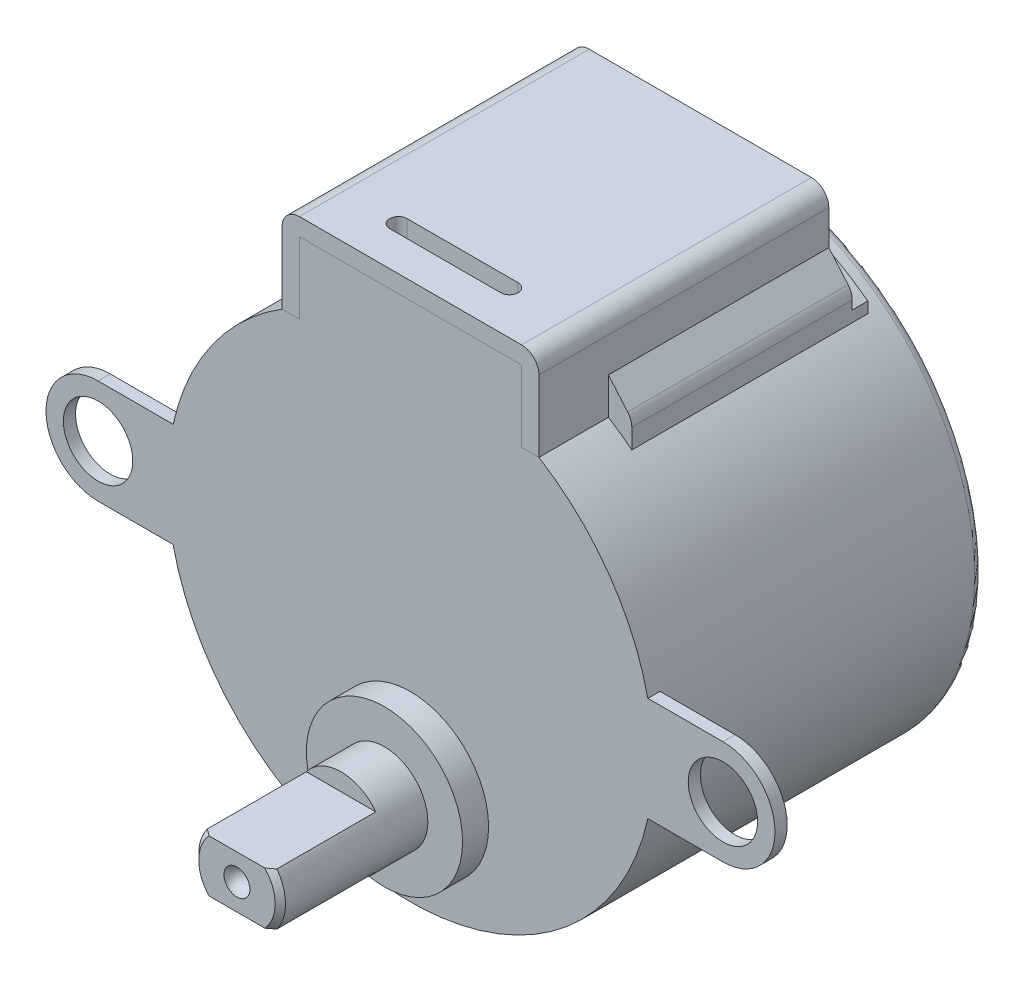
from build123d import *

# Parameters (mm, degrees)
IZIM1_R                     = 14
Y_KSEKLIK_EKSTR_ZYON1_DEPTH = 19
IZIM2_R                     = 4.5
Y_KSEKLIK_EKSTR_ZYON2_DEPTH = 1.5
IZIM3_R                     = 2.5
Y_KSEKLIK_EKSTR_ZYON3_DEPTH = 8.5
KES_EKSTR_ZYON1_DEPTH       = 6
PAH1_SIZE                   = 0.3
Y_KSEKLIK_EKSTR_ZYON4_START = -16.7
Y_KSEKLIK_EKSTR_ZYON4_DEPTH = 16.7
RADYUS2_R                   = 1
Y_KSEKLIK_EKSTR_ZYON5_DEPTH = 12.7
Y_KSEKLIK_EKSTR_ZYON6_START = 0.9
Y_KSEKLIK_EKSTR_ZYON6_DEPTH = 0.9
KES_EKSTR_ZYON2_DEPTH       = 2.3
RADYUS3_R                   = 0.5
Y_KSEKLIK_EKSTR_ZYON7_START = -0.7
IZIM10_R                    = 2
Y_KSEKLIK_EKSTR_ZYON7_DEPTH = 0.7
IZIM11_W                    = 1.346153846
IZIM11_H                    = 0.358974359
KES_EKSTR_ZYON3_DEPTH       = 0.3
Y_KSEKLIK_EKSTR_ZYON8_START = 0.001
Y_KSEKLIK_EKSTR_ZYON8_DEPTH = 0.001
BODY_MOVE_COPY1_ANGLE       = 179.5
BODY_MOVE_COPY2_ANGLE       = 0.5


with BuildPart() as part:
    # Çizim1 → Yükseklik-Ekstrüzyon1 (new body)
    with BuildSketch(Plane.XY):
        Circle(IZIM1_R)
    extrude(amount=Y_KSEKLIK_EKSTR_ZYON1_DEPTH)

    # Çizim2 → Yükseklik-Ekstrüzyon2 (add)
    with BuildSketch(Plane.XY.offset(19)):
        with Locations((0, 8)):
            Circle(IZIM2_R)
    extrude(amount=Y_KSEKLIK_EKSTR_ZYON2_DEPTH)

    # Çizim3 → Yükseklik-Ekstrüzyon3 (add)
    with BuildSketch(Plane.XY.offset(20.5)):
        with Locations((0, 8)):
            Circle(IZIM3_R)
    extrude(amount=Y_KSEKLIK_EKSTR_ZYON3_DEPTH)

    # Çizim4 → Kes-Ekstrüzyon1 (cut)
    with BuildSketch(Plane.XY.offset(29)):
        Polygon((0, 9.5), (2.176763418, 9.5), (2.176763418, 10.5), (-2.399726215, 10.5), (-2.399726215, 9.5), align=None)
        Polygon((2.176763418, 5.5), (-2.399726215, 5.5), (-2.399726215, 6.5), (0, 6.5), (2.176763418, 6.5), align=None)
    extrude(amount=-KES_EKSTR_ZYON1_DEPTH, mode=Mode.SUBTRACT)

    # Pah1
    pah1_edges = [part.edges().sort_by_distance(p)[0] for p in [
        (-2.5, 8, 29),
        (2.371708245, 8.790569415, 29),
    ]]
    chamfer(pah1_edges, length=PAH1_SIZE)

    # Çizim5 → Kes-Döndür1 (revolve, cut)
    with BuildSketch(Plane.XY.offset(29)):
        with BuildLine():
            Line((0, 8.75), (0, 7.25))
            ThreePointArc((0, 7.25), (0.75, 8), (0, 8.75))
        make_face()
    revolve(axis=Axis((0, 8.75, 29), (0, -1, 0)), mode=Mode.SUBTRACT)

    # Çizim6 → Yükseklik-Ekstrüzyon4 (add)
    with BuildSketch(Plane.XY.offset(19).offset(Y_KSEKLIK_EKSTR_ZYON4_START)):
        with BuildLine():
            Line((0, -17), (7.4, -17))
            Line((7.4, -17), (7.4, -11.884443613))
            ThreePointArc((7.4, -11.884443613), (0, -14), (-7.4, -11.884443613))
            Line((-7.4, -11.884443613), (-7.4, -17))
            Line((-7.4, -17), (0, -17))
        make_face()
    extrude(amount=Y_KSEKLIK_EKSTR_ZYON4_DEPTH)

    # Radyus2
    radyus2_edges = [part.edges().sort_by_distance(p)[0] for p in [
        (-7.4, -17, 10.65),
        (7.4, -17, 10.65),
    ]]
    fillet(radyus2_edges, radius=RADYUS2_R)

    # Çizim7 → Yükseklik-Ekstrüzyon5 (add)
    with BuildSketch(Plane(origin=(0, 0, 2.3), x_dir=(-1, 0, 0), z_dir=(0, 0, -1))):
        with BuildLine():
            Line((7.4, -14), (7.4, -10.928746497))
            Line((7.4, -10.928746497), (8.75, -10.928746497))
            Line((8.75, -10.928746497), (8.75, -12.058153251))
            ThreePointArc((8.75, -12.058153251), (8.687680677, -12.405651377), (8.508490105, -12.709837807))
            Line((8.508490105, -12.709837807), (7.4, -14))
        make_face()
        with BuildLine():
            Line((-7.4, -14), (-7.4, -10.928746497))
            Line((-7.4, -10.928746497), (-8.75, -10.928746497))
            Line((-8.75, -10.928746497), (-8.75, -12.058153251))
            ThreePointArc((-8.75, -12.058153251), (-8.687680677, -12.405651377), (-8.508490105, -12.709837807))
            Line((-8.508490105, -12.709837807), (-7.4, -14))
        make_face()
    extrude(amount=-Y_KSEKLIK_EKSTR_ZYON5_DEPTH)

    # Çizim8 → Yükseklik-Ekstrüzyon6 (add)
    with BuildSketch(Plane(origin=(0, 0, 2.3), x_dir=(-1, 0, 0), z_dir=(0, 0, -1)).offset(Y_KSEKLIK_EKSTR_ZYON6_START)):
        with BuildLine():
            Line((-8.75, -10.928746497), (-8.75, -11.56233108))
            ThreePointArc((-8.75, -11.56233108), (-5.320746645, -13.488500849), (-1.5, -14.422205102))
            Line((-1.5, -14.422205102), (-1.5, -13.919410907))
            ThreePointArc((-1.5, -13.919410907), (-5.338693043, -12.942115615), (-8.75, -10.928746497))
        make_face()
        with BuildLine():
            Line((8.75, -10.928746497), (8.75, -11.56233108))
            ThreePointArc((8.75, -11.56233108), (5.320746645, -13.488500849), (1.5, -14.422205102))
            Line((1.5, -14.422205102), (1.5, -13.919410907))
            ThreePointArc((1.5, -13.919410907), (5.338693043, -12.942115615), (8.75, -10.928746497))
        make_face()
    extrude(amount=-Y_KSEKLIK_EKSTR_ZYON6_DEPTH)

    # Çizim9 → Kes-Ekstrüzyon2 (cut)
    with BuildSketch(Plane.XZ.offset(17)):
        with BuildLine():
            Line((3.2, 17), (-3.2, 17))
            ThreePointArc((-3.2, 17), (-3.7, 16.5), (-3.2, 16))
            Line((-3.2, 16), (3.2, 16))
            ThreePointArc((3.2, 16), (3.7, 16.5), (3.2, 17))
        make_face()
    extrude(amount=-KES_EKSTR_ZYON2_DEPTH, mode=Mode.SUBTRACT)

    # Radyus3
    radyus3_edges = [part.edges().sort_by_distance(p)[0] for p in [
        (-14, 0, 0),
    ]]
    fillet(radyus3_edges, radius=RADYUS3_R)

    # Çizim10 → Yükseklik-Ekstrüzyon7 (add)
    # profile 1 of 2: a face of its own
    with BuildSketch(Plane.XY.offset(19).offset(Y_KSEKLIK_EKSTR_ZYON7_START)):
        with BuildLine():
            Line((18, 3), (13.674794331, 3))
            ThreePointArc((13.674794331, 3), (14, 0), (13.674794331, -3))
            Line((13.674794331, -3), (18, -3))
            ThreePointArc((18, -3), (21, 0), (18, 3))
        make_face()
        with Locations((18, 0)):
            Circle(IZIM10_R, mode=Mode.SUBTRACT)
    # profile 2 of 2: a face of its own
    with BuildSketch(Plane.XY.offset(19).offset(Y_KSEKLIK_EKSTR_ZYON7_START)):
        with BuildLine():
            Line((-18, -3), (-13.674794331, -3))
            ThreePointArc((-13.674794331, -3), (-14, 0), (-13.674794331, 3))
            Line((-13.674794331, 3), (-18, 3))
            ThreePointArc((-18, 3), (-21, 0), (-18, -3))
        make_face()
        with Locations(Location((-18, 0, 0), (0, 0, 180))):
            Circle(IZIM10_R, mode=Mode.SUBTRACT)
    extrude(amount=Y_KSEKLIK_EKSTR_ZYON7_DEPTH)

    # Çizim11 → Kes-Ekstrüzyon3 (cut)
    # profile 1 of 8: a face of its own
    with BuildSketch(Plane(origin=(0, 0, 0), x_dir=(-1, 0, 0), z_dir=(0, 0, -1))):
        with BuildLine():
            Line((-9.138088726, 0.683464408), (-9.45219129, 0.683464408))
            add(Edge.make_bspline(
                [(-9.45219129, 0.683464408), (-9.450144137, 0.725135295), (-9.446123583, 0.80697581), (-9.427295294, 0.926299716), (-9.400354417, 1.040354515), (-9.362262963, 1.148224429), (-9.314956685, 1.250863236), (-9.258226658, 1.347863252), (-9.191032807, 1.438854441), (-9.114826073, 1.522993284), (-9.032057434, 1.600180855), (-8.942751494, 1.666836098), (-8.848906467, 1.723153769), (-8.750807068, 1.770235011), (-8.647346505, 1.805574857), (-8.539463647, 1.831796496), (-8.42668451, 1.847572842), (-8.349844488, 1.849268628), (-8.310765008, 1.850131074)],
                knots=[0, 0, 0, 0, 1.10065271, 2.161652631, 3.183658789, 4.190468796, 5.17591951, 6.163126047, 7.15150782, 8.156236427, 9.156009102, 10.134482811, 11.092018607, 12.041330605, 13.001268258, 13.972401359, 14.968799086, 16, 16, 16, 16], degree=3))
            add(Edge.make_bspline(
                [(-8.310765008, 1.850131074), (-8.272386934, 1.849232618), (-8.196975389, 1.847467183), (-8.086913375, 1.832306154), (-7.982136081, 1.808560562), (-7.882848314, 1.775245146), (-7.789842249, 1.730460718), (-7.702419205, 1.67666318), (-7.619538394, 1.614443348), (-7.54493161, 1.541189535), (-7.476423531, 1.46298715), (-7.417321276, 1.379499247), (-7.366708113, 1.293269961), (-7.324520433, 1.203641759), (-7.293464294, 1.109770731), (-7.269886086, 1.013023528), (-7.256558672, 0.912398717), (-7.254513249, 0.844292162), (-7.253473341, 0.809666331)],
                knots=[0, 0, 0, 0, 1.111607364, 2.184268762, 3.212621178, 4.221274766, 5.211760367, 6.196651075, 7.1921475, 8.207485113, 9.220403448, 10.201281604, 11.166441695, 12.114753415, 13.065576456, 14.026450734, 14.996634279, 16, 16, 16, 16], degree=3))
            add(Edge.make_bspline(
                [(-7.253473341, 0.809666331), (-7.255166604, 0.760918496), (-7.258523416, 0.664278282), (-7.287237792, 0.52226342), (-7.332084303, 0.384670001), (-7.38608166, 0.273932698), (-7.440554104, 0.184699205), (-7.489641612, 0.1112305), (-7.547106423, 0.032125031), (-7.613784921, -0.052352306), (-7.688297793, -0.142863211), (-7.771319956, -0.239353006), (-7.863443438, -0.340824776), (-7.928101939, -0.410130378), (-7.961606354, -0.446042804)],
                knots=[0, 0, 0, 0, 1.184426356, 2.348067706, 3.509069118, 4.696110526, 5.333549288, 6.050745305, 6.844228056, 7.710549037, 8.667450064, 9.695053472, 10.805634456, 12, 12, 12, 12], degree=3))
            Line((-7.961606354, -0.446042804), (-8.837307476, -1.380638157))
            Line((-8.837307476, -1.380638157), (-7.208601547, -1.380638157))
            Line((-7.208601547, -1.380638157), (-7.208601547, -1.739612516))
            Line((-7.208601547, -1.739612516), (-9.586806675, -1.739612516))
            Line((-9.586806675, -1.739612516), (-8.22943488, -0.291094887))
            add(Edge.make_bspline(
                [(-8.22943488, -0.291094887), (-8.196386993, -0.256596581), (-8.132908766, -0.190332394), (-8.043126189, -0.093589434), (-7.962487201, -0.003839893), (-7.890469808, 0.078746655), (-7.828636303, 0.155378223), (-7.773764071, 0.223572927), (-7.72979848, 0.286327377), (-7.682083084, 0.359067991), (-7.635869103, 0.447880308), (-7.596156747, 0.556413997), (-7.571941898, 0.66814125), (-7.569037063, 0.743643287), (-7.567575906, 0.781621459)],
                knots=[0, 0, 0, 0, 1.329631726, 2.553950428, 3.673215718, 4.687767853, 5.603093632, 6.413772471, 7.123043292, 7.734684054, 8.834405432, 9.900288307, 10.943827018, 12, 12, 12, 12], degree=3))
            add(Edge.make_bspline(
                [(-7.567575906, 0.781621459), (-7.568211648, 0.805502857), (-7.569464574, 0.852568508), (-7.580522271, 0.921574267), (-7.597232777, 0.98813908), (-7.621178036, 1.0524677), (-7.652784776, 1.113913352), (-7.691258156, 1.172550832), (-7.735648219, 1.229239797), (-7.786999488, 1.282393095), (-7.843411008, 1.331074301), (-7.903005258, 1.374198386), (-7.966055362, 1.410237497), (-8.032295484, 1.439780994), (-8.101540954, 1.462956375), (-8.173925699, 1.479014955), (-8.249249715, 1.489097439), (-8.300683211, 1.49046161), (-8.326890809, 1.491156715)],
                knots=[0, 0, 0, 0, 0.991446411, 1.95395049, 2.89581595, 3.838931463, 4.798493298, 5.75982156, 6.748411868, 7.785213223, 8.824556874, 9.840280684, 10.836137867, 11.835679398, 12.848801643, 13.863922112, 14.911575587, 16, 16, 16, 16], degree=3))
            add(Edge.make_bspline(
                [(-8.326890809, 1.491156715), (-8.354261642, 1.490441683), (-8.408013438, 1.489037478), (-8.486932471, 1.479214814), (-8.562218249, 1.462268973), (-8.634060152, 1.439092299), (-8.702579738, 1.40963375), (-8.767443782, 1.372942005), (-8.828506671, 1.329158512), (-8.885883194, 1.279517956), (-8.938747173, 1.224250355), (-8.985194049, 1.162640392), (-9.025778063, 1.095812976), (-9.061187297, 1.023948426), (-9.089942987, 0.946394646), (-9.111916137, 0.863426941), (-9.129302984, 0.775405559), (-9.135111505, 0.714620475), (-9.138088726, 0.683464408)],
                knots=[0, 0, 0, 0, 1.031018746, 2.02475058, 2.990194455, 3.934040569, 4.864654155, 5.795059489, 6.735614925, 7.690564532, 8.649604399, 9.611025574, 10.590972636, 11.591080095, 12.624614302, 13.701020113, 14.821632451, 16, 16, 16, 16], degree=3))
        make_face()
    # profile 2 of 8: a face of its own
    with BuildSketch(Plane(origin=(0, 0, 0), x_dir=(-1, 0, 0), z_dir=(0, 0, -1))):
        with BuildLine():
            add(Edge.make_bspline(
                [(-5.192876386, 0.210207196), (-5.164227839, 0.19526924), (-5.108353605, 0.166135237), (-5.028776396, 0.119224409), (-4.956051395, 0.069783445), (-4.888160833, 0.020147585), (-4.826297483, -0.031584066), (-4.77115307, -0.085617222), (-4.72136545, -0.140603168), (-4.677938666, -0.197473008), (-4.639741829, -0.256075657), (-4.606729694, -0.31656493), (-4.578512491, -0.378808264), (-4.556149552, -0.443485094), (-4.537727761, -0.509645355), (-4.525052156, -0.578143337), (-4.518235238, -0.648527678), (-4.516946424, -0.69609598), (-4.516293854, -0.720181426)],
                knots=[0, 0, 0, 0, 1.272397273, 2.481599622, 3.635517121, 4.734568067, 5.792894095, 6.808321871, 7.773003508, 8.711915296, 9.623354172, 10.525449501, 11.423591555, 12.311487226, 13.218079475, 14.126165749, 15.051214107, 16, 16, 16, 16], degree=3))
            add(Edge.make_bspline(
                [(-4.516293854, -0.720181426), (-4.517065275, -0.753879158), (-4.518592206, -0.820579615), (-4.53189219, -0.919025727), (-4.551805168, -1.014637509), (-4.58088468, -1.107393999), (-4.618598071, -1.196783373), (-4.665074907, -1.282882146), (-4.717686112, -1.367101455), (-4.759938352, -1.418920857), (-4.781317893, -1.445141362)],
                knots=[0, 0, 0, 0, 1.025265484, 2.029385089, 3.018602448, 3.995076438, 4.983346944, 5.966715145, 6.97116228, 8, 8, 8, 8], degree=3))
            add(Edge.make_bspline(
                [(-4.781317893, -1.445141362), (-4.809154367, -1.475735136), (-4.864483333, -1.536544629), (-4.95926626, -1.615495439), (-5.063288144, -1.681844833), (-5.176146477, -1.735916727), (-5.297539578, -1.778002586), (-5.427441583, -1.808245104), (-5.566105736, -1.825567533), (-5.661411207, -1.828071523), (-5.710304271, -1.829356105)],
                knots=[0, 0, 0, 0, 0.954267603, 1.896743057, 2.838368354, 3.796610408, 4.779680527, 5.799409237, 6.871065594, 8, 8, 8, 8], degree=3))
            add(Edge.make_bspline(
                [(-5.710304271, -1.829356105), (-5.75731766, -1.828203627), (-5.848800939, -1.825961022), (-5.981958816, -1.810766591), (-6.106081886, -1.784138724), (-6.221891854, -1.747694115), (-6.328690548, -1.700283886), (-6.426173649, -1.641275478), (-6.515747621, -1.573044035), (-6.594694095, -1.493629957), (-6.664782538, -1.408572085), (-6.726350592, -1.320820475), (-6.77752467, -1.230367118), (-6.820851765, -1.13856075), (-6.854019788, -1.044114596), (-6.876991998, -0.947514583), (-6.891581312, -0.84892944), (-6.893522447, -0.782397787), (-6.894498983, -0.748927419)],
                knots=[0, 0, 0, 0, 1.256902934, 2.445805442, 3.576955095, 4.645999104, 5.686449165, 6.692658513, 7.68621702, 8.689161843, 9.678783111, 10.630372946, 11.551080876, 12.453998257, 13.34127905, 14.221779781, 15.105423033, 16, 16, 16, 16], degree=3))
            add(Edge.make_bspline(
                [(-6.894498983, -0.748927419), (-6.893921101, -0.724368227), (-6.892779005, -0.675830595), (-6.884874156, -0.604121267), (-6.872165695, -0.534325132), (-6.854906238, -0.466184389), (-6.831515212, -0.400195116), (-6.803273079, -0.336044643), (-6.770341126, -0.273660544), (-6.732259961, -0.212701663), (-6.687957937, -0.15402215), (-6.637794287, -0.096626156), (-6.580766419, -0.041404289), (-6.51750876, 0.012318136), (-6.44874422, 0.06549411), (-6.37268669, 0.115249839), (-6.291352422, 0.165107804), (-6.233547016, 0.194916129), (-6.203894015, 0.210207196)],
                knots=[0, 0, 0, 0, 0.941657376, 1.861047343, 2.762797495, 3.66048619, 4.553285746, 5.444104102, 6.34607688, 7.256116206, 8.197091036, 9.162375105, 10.176350973, 11.237807142, 12.343728897, 13.50695164, 14.721116704, 16, 16, 16, 16], degree=3))
            add(Edge.make_bspline(
                [(-6.203894015, 0.210207196), (-6.244485389, 0.232341965), (-6.323081652, 0.275201072), (-6.427151093, 0.353947878), (-6.516541717, 0.439235693), (-6.588796434, 0.532865488), (-6.645668662, 0.631912362), (-6.684687267, 0.735756615), (-6.711083751, 0.842472728), (-6.713698578, 0.915378925), (-6.715011803, 0.951994055)],
                knots=[0, 0, 0, 0, 1.166880483, 2.259407225, 3.286803203, 4.280235371, 5.237608625, 6.161067461, 7.076446754, 8, 8, 8, 8], degree=3))
            add(Edge.make_bspline(
                [(-6.715011803, 0.951994055), (-6.713376379, 0.989291613), (-6.710088891, 1.06426621), (-6.683505571, 1.175872334), (-6.640185504, 1.285488899), (-6.581264507, 1.392584611), (-6.507877291, 1.493534826), (-6.419830745, 1.584075772), (-6.319227448, 1.663387255), (-6.206569581, 1.729963428), (-6.085333346, 1.784147086), (-5.957417622, 1.821525509), (-5.825051129, 1.845961626), (-5.734953409, 1.848728281), (-5.689270617, 1.850131074)],
                knots=[0, 0, 0, 0, 0.888701115, 1.786444228, 2.72001202, 3.692817113, 4.693886446, 5.687152267, 6.695133018, 7.739871481, 8.800368666, 9.853104506, 10.91144658, 12, 12, 12, 12], degree=3))
            add(Edge.make_bspline(
                [(-5.689270617, 1.850131074), (-5.644766802, 1.848684731), (-5.557010349, 1.845832707), (-5.428015721, 1.822045829), (-5.304590844, 1.782316309), (-5.187161345, 1.728419086), (-5.077829478, 1.662032145), (-4.981227168, 1.581631271), (-4.895894586, 1.491489721), (-4.825310192, 1.390570117), (-4.767147303, 1.283885924), (-4.726646402, 1.172263403), (-4.700694428, 1.058114344), (-4.697421063, 0.98087634), (-4.695781034, 0.94217835)],
                knots=[0, 0, 0, 0, 1.072916533, 2.115669174, 3.151510826, 4.193348718, 5.225979165, 6.227137561, 7.216255879, 8.211077061, 9.189680878, 10.138522389, 11.067357538, 12, 12, 12, 12], degree=3))
            add(Edge.make_bspline(
                [(-4.695781034, 0.94217835), (-4.697215594, 0.904201686), (-4.70003299, 0.829617677), (-4.72373293, 0.720891156), (-4.763646243, 0.619069117), (-4.818140406, 0.522996165), (-4.889165894, 0.434414667), (-4.975774627, 0.352198198), (-5.077276105, 0.275671369), (-5.153536991, 0.232485005), (-5.192876386, 0.210207196)],
                knots=[0, 0, 0, 0, 0.975232327, 1.915300861, 2.843280834, 3.77672583, 4.742871857, 5.749627742, 6.839139064, 8, 8, 8, 8], degree=3))
        make_face()
        with BuildLine():
            add(Edge.make_bspline(
                [(-5.706798662, 1.491156715), (-5.731349468, 1.490505275), (-5.779381579, 1.489230772), (-5.84981025, 1.482572135), (-5.916782617, 1.469618918), (-5.980998418, 1.452380207), (-6.04157723, 1.429092219), (-6.099341785, 1.401697209), (-6.153308975, 1.368391144), (-6.204130278, 1.331029946), (-6.249881052, 1.28993704), (-6.290485604, 1.247123321), (-6.324213718, 1.201747929), (-6.352854828, 1.154939569), (-6.373636345, 1.105308993), (-6.389200649, 1.054377817), (-6.39972204, 1.001502433), (-6.40051043, 0.965365922), (-6.400909239, 0.947086202)],
                knots=[0, 0, 0, 0, 1.203892937, 2.355340988, 3.463153438, 4.544400666, 5.610487187, 6.640501085, 7.674077295, 8.714426146, 9.728707835, 10.68524104, 11.601827946, 12.495867327, 13.368432065, 14.231010473, 15.105153427, 16, 16, 16, 16], degree=3))
            add(Edge.make_bspline(
                [(-6.400909239, 0.947086202), (-6.400221872, 0.928805693), (-6.398863536, 0.89268078), (-6.388358408, 0.839334914), (-6.372701553, 0.786913277), (-6.348050892, 0.736662366), (-6.318484534, 0.686839007), (-6.281993058, 0.638688421), (-6.23850403, 0.592043036), (-6.189476589, 0.547299595), (-6.136065052, 0.505400832), (-6.079481008, 0.46902765), (-6.020434617, 0.43859354), (-5.959532548, 0.413264135), (-5.8961541, 0.393574198), (-5.830687627, 0.379605551), (-5.763122125, 0.370923554), (-5.717341544, 0.369886533), (-5.69417847, 0.369361843)],
                knots=[0, 0, 0, 0, 0.873023192, 1.725219244, 2.590779336, 3.480155217, 4.391973325, 5.357036234, 6.360879153, 7.436073238, 8.526419356, 9.601555421, 10.645666583, 11.697338044, 12.750135903, 13.812665442, 14.89329948, 16, 16, 16, 16], degree=3))
            add(Edge.make_bspline(
                [(-5.69417847, 0.369361843), (-5.664428366, 0.370234711), (-5.605221998, 0.371971824), (-5.517942667, 0.388122997), (-5.433080022, 0.413528915), (-5.351541118, 0.448288881), (-5.275436533, 0.491916741), (-5.207596464, 0.544149759), (-5.148599572, 0.603781856), (-5.099058961, 0.669884692), (-5.060649115, 0.740236281), (-5.030747307, 0.810836573), (-5.013286092, 0.882438804), (-5.011008525, 0.930405768), (-5.009883598, 0.95409742)],
                knots=[0, 0, 0, 0, 1.076279235, 2.141928126, 3.20205304, 4.278698113, 5.344010996, 6.36967002, 7.368914609, 8.37248503, 9.349703398, 10.264243087, 11.142681841, 12, 12, 12, 12], degree=3))
            add(Edge.make_bspline(
                [(-5.009883598, 0.95409742), (-5.010415495, 0.970725456), (-5.011471236, 1.003729724), (-5.020171292, 1.05246809), (-5.034547125, 1.100097673), (-5.054010205, 1.147011944), (-5.07962, 1.192552676), (-5.109984187, 1.237435764), (-5.146868689, 1.280651528), (-5.188265122, 1.323207076), (-5.235210531, 1.3625911), (-5.287614443, 1.39722581), (-5.345208193, 1.426638167), (-5.407993143, 1.450526921), (-5.475738067, 1.468469271), (-5.548130942, 1.481905619), (-5.625775389, 1.48947873), (-5.67920514, 1.490585256), (-5.706798662, 1.491156715)],
                knots=[0, 0, 0, 0, 0.814439003, 1.616544685, 2.417341072, 3.248991801, 4.09997495, 4.973547432, 5.9003056, 6.880240646, 7.880314356, 8.896779544, 9.951930927, 11.043077905, 12.18215768, 13.381699519, 14.647792085, 16, 16, 16, 16], degree=3))
        make_face(mode=Mode.SUBTRACT)
        with BuildLine():
            add(Edge.make_bspline(
                [(-5.68646613, 0.010387484), (-5.717591916, 0.009833843), (-5.778653112, 0.008747734), (-5.86811004, -0.003341767), (-5.953963206, -0.02017116), (-6.035923142, -0.045701998), (-6.113955239, -0.078898488), (-6.188481921, -0.118833028), (-6.258933051, -0.166038472), (-6.324335777, -0.219915087), (-6.384059107, -0.277974541), (-6.436457407, -0.339436676), (-6.480954927, -0.403159209), (-6.516788178, -0.469951438), (-6.54619991, -0.538399049), (-6.565513787, -0.610206644), (-6.577895499, -0.683993758), (-6.579558131, -0.734153856), (-6.580396418, -0.759444246)],
                knots=[0, 0, 0, 0, 1.140299081, 2.23698856, 3.303958914, 4.344563908, 5.37730929, 6.408454204, 7.439741482, 8.480804886, 9.510774543, 10.48932336, 11.43758569, 12.353841022, 13.263987381, 14.161954604, 15.073269652, 16, 16, 16, 16], degree=3))
            add(Edge.make_bspline(
                [(-6.580396418, -0.759444246), (-6.57903316, -0.790875152), (-6.576328486, -0.853233336), (-6.554871847, -0.945396407), (-6.520436312, -1.034617462), (-6.472411096, -1.120169415), (-6.412943523, -1.200119521), (-6.339817055, -1.269808297), (-6.257576218, -1.331729775), (-6.163438364, -1.381810309), (-6.060609897, -1.421805164), (-5.949118169, -1.449361126), (-5.83056325, -1.467602576), (-5.748703658, -1.469440757), (-5.706798662, -1.470381746)],
                knots=[0, 0, 0, 0, 0.898778495, 1.783155532, 2.693654817, 3.627872908, 4.583023416, 5.533784346, 6.509005473, 7.520592997, 8.575161974, 9.658835044, 10.801527049, 12, 12, 12, 12], degree=3))
            add(Edge.make_bspline(
                [(-5.706798662, -1.470381746), (-5.674048294, -1.469752938), (-5.610240075, -1.468527817), (-5.517154126, -1.457713523), (-5.429309578, -1.440563898), (-5.346876779, -1.415620353), (-5.268932939, -1.385170376), (-5.196799585, -1.345998295), (-5.128621058, -1.301445972), (-5.067756936, -1.248587815), (-5.012323727, -1.19210832), (-4.963990434, -1.132318277), (-4.922032883, -1.070842645), (-4.889101927, -1.00629216), (-4.862775674, -0.939905246), (-4.843852119, -0.871069734), (-4.832175904, -0.799574501), (-4.830995008, -0.75107543), (-4.830396418, -0.726491522)],
                knots=[0, 0, 0, 0, 1.224942928, 2.386581632, 3.501229538, 4.569074225, 5.605009692, 6.626002462, 7.634866581, 8.645888296, 9.63523824, 10.59253846, 11.518950513, 12.414518923, 13.29783783, 14.186679152, 15.080837789, 16, 16, 16, 16], degree=3))
            add(Edge.make_bspline(
                [(-4.830396418, -0.726491522), (-4.831302267, -0.702614181), (-4.833088442, -0.655532237), (-4.844425133, -0.58576571), (-4.864341011, -0.518362896), (-4.891668407, -0.45251289), (-4.92804937, -0.389549939), (-4.97089424, -0.327833768), (-5.022588359, -0.269077323), (-5.081000955, -0.212824227), (-5.144659916, -0.160808491), (-5.21232706, -0.114794052), (-5.283481522, -0.076041936), (-5.357972733, -0.04452544), (-5.435635289, -0.019737971), (-5.516412068, -0.002421975), (-5.600397643, 0.008477627), (-5.657452513, 0.009743673), (-5.68646613, 0.010387484)],
                knots=[0, 0, 0, 0, 0.917430815, 1.809013306, 2.70690318, 3.612392954, 4.541220862, 5.495268465, 6.494511384, 7.542276156, 8.608045339, 9.649016899, 10.681629292, 11.715607085, 12.752076957, 13.808767841, 14.885711793, 16, 16, 16, 16], degree=3))
        make_face(mode=Mode.SUBTRACT)
    # profile 3 of 8: a face of its own
    with BuildSketch(Plane(origin=(0, 0, 0), x_dir=(-1, 0, 0), z_dir=(0, 0, -1))):
        with BuildLine():
            Line((-3.888088726, 1.760387484), (-3.205196098, 1.760387484))
            add(Edge.make_bspline(
                [(-3.205196098, 1.760387484), (-3.17176762, 1.760211734), (-3.106974909, 1.759871086), (-3.012755468, 1.754587955), (-2.924506657, 1.747384285), (-2.842202885, 1.735954192), (-2.765882182, 1.722162415), (-2.695314545, 1.705460599), (-2.630724373, 1.685433985), (-2.553611636, 1.653587704), (-2.465690975, 1.606264536), (-2.370492583, 1.536335971), (-2.289088343, 1.450803508), (-2.218902026, 1.354320852), (-2.163100906, 1.24818508), (-2.122731609, 1.134925892), (-2.097173734, 1.01600415), (-2.0945453, 0.934360972), (-2.093216931, 0.893099824)],
                knots=[0, 0, 0, 0, 1.001505555, 1.941167018, 2.826882275, 3.653841531, 4.429895133, 5.150066043, 5.825578002, 6.45369114, 7.647487171, 8.808567382, 9.977351308, 11.170798116, 12.373658725, 13.556498008, 14.765093433, 16, 16, 16, 16], degree=3))
            add(Edge.make_bspline(
                [(-2.093216931, 0.893099824), (-2.09431015, 0.854447269), (-2.096458427, 0.778491351), (-2.117001186, 0.667397242), (-2.149161855, 0.561646023), (-2.193867104, 0.461623638), (-2.2519691, 0.369590025), (-2.320827419, 0.284802759), (-2.403904221, 0.210851702), (-2.466147461, 0.169508799), (-2.497764207, 0.148508478)],
                knots=[0, 0, 0, 0, 1.044552857, 2.05264487, 3.044412934, 4.028983338, 5.005914585, 5.980388656, 6.974128949, 8, 8, 8, 8], degree=3))
            add(Edge.make_bspline(
                [(-2.497764207, 0.148508478), (-2.458003779, 0.133243479), (-2.381932232, 0.104037755), (-2.277246219, 0.052402291), (-2.187051374, -0.00375982), (-2.110654228, -0.06509167), (-2.045316574, -0.131200481), (-1.988263632, -0.203055595), (-1.939582258, -0.281594353), (-1.897869334, -0.365997888), (-1.865320578, -0.455404356), (-1.840944674, -0.548975133), (-1.826977225, -0.646374688), (-1.824989583, -0.712660067), (-1.823986162, -0.746122932)],
                knots=[0, 0, 0, 0, 1.27268992, 2.434971085, 3.483601985, 4.442670788, 5.356604649, 6.2567628, 7.179492994, 8.113709626, 9.066344395, 10.018646069, 10.999752585, 12, 12, 12, 12], degree=3))
            add(Edge.make_bspline(
                [(-1.823986162, -0.746122932), (-1.824963008, -0.780289804), (-1.82688498, -0.847514082), (-1.841064952, -0.946269217), (-1.865074059, -1.040644164), (-1.898145205, -1.131249346), (-1.94130752, -1.217909481), (-1.993835484, -1.300722745), (-2.056467048, -1.378857075), (-2.126529917, -1.453180698), (-2.205792062, -1.520008486), (-2.291307817, -1.579524193), (-2.384154137, -1.628470255), (-2.482806131, -1.669586276), (-2.588370447, -1.700993475), (-2.700373054, -1.722966048), (-2.818717356, -1.737771085), (-2.899927107, -1.73898829), (-2.941574303, -1.739612516)],
                knots=[0, 0, 0, 0, 0.978564426, 1.925352924, 2.850884081, 3.763762016, 4.682927383, 5.618979971, 6.567305752, 7.547517671, 8.540179244, 9.531824382, 10.526200242, 11.540722885, 12.589160233, 13.674978461, 14.80764778, 16, 16, 16, 16], degree=3))
            Line((-2.941574303, -1.739612516), (-3.888088726, -1.739612516))
            Line((-3.888088726, -1.739612516), (-3.888088726, 1.760387484))
        make_face()
        with BuildLine():
            Line((-3.573986162, 1.401413125), (-3.573986162, 0.279618254))
            Line((-3.573986162, 0.279618254), (-3.362948502, 0.279618254))
            add(Edge.make_bspline(
                [(-3.362948502, 0.279618254), (-3.332099706, 0.280018177), (-3.272493547, 0.280790909), (-3.186173651, 0.283004426), (-3.106048632, 0.28920247), (-3.032256799, 0.295398732), (-2.964914355, 0.30547332), (-2.904170494, 0.317465443), (-2.849071897, 0.330148348), (-2.785532351, 0.351717835), (-2.713459403, 0.38359551), (-2.636626299, 0.433067346), (-2.568891829, 0.491991699), (-2.511694641, 0.559982661), (-2.464883171, 0.634848847), (-2.432369456, 0.715395727), (-2.410322172, 0.799615859), (-2.40833064, 0.857434112), (-2.407319495, 0.886789728)],
                knots=[0, 0, 0, 0, 1.156816544, 2.235205308, 3.236616184, 4.169592532, 5.011045266, 5.787822928, 6.49130361, 7.128639758, 8.301311294, 9.436451833, 10.541879658, 11.654887649, 12.756523258, 13.837046038, 14.901820046, 16, 16, 16, 16], degree=3))
            add(Edge.make_bspline(
                [(-2.407319495, 0.886789728), (-2.407845676, 0.9062155), (-2.408877835, 0.944321272), (-2.417331138, 0.999870626), (-2.431698712, 1.052114378), (-2.450153006, 1.101768489), (-2.475941694, 1.147280339), (-2.506305158, 1.190223535), (-2.542990848, 1.229135653), (-2.584748161, 1.265505151), (-2.632756784, 1.297749679), (-2.686988075, 1.325990442), (-2.748175752, 1.348731219), (-2.815288607, 1.368647372), (-2.889359695, 1.382635665), (-2.969534248, 1.394289053), (-3.056468967, 1.400221795), (-3.11661407, 1.401007158), (-3.147704111, 1.401413125)],
                knots=[0, 0, 0, 0, 0.91205012, 1.789085906, 2.630437955, 3.453916878, 4.269457761, 5.079663411, 5.91843418, 6.774407191, 7.675494373, 8.627863946, 9.638891023, 10.736472738, 11.911756761, 13.175263542, 14.539845004, 16, 16, 16, 16], degree=3))
            Line((-3.147704111, 1.401413125), (-3.573986162, 1.401413125))
        make_face(mode=Mode.SUBTRACT)
        with BuildLine():
            Line((-3.573986162, -0.079356105), (-3.573986162, -1.380638157))
            Line((-3.573986162, -1.380638157), (-3.126670457, -1.380638157))
            add(Edge.make_bspline(
                [(-3.126670457, -1.380638157), (-3.094651531, -1.380254409), (-3.032939272, -1.379514787), (-2.943838042, -1.377100232), (-2.861254938, -1.371607956), (-2.785566803, -1.362962107), (-2.71595635, -1.353583658), (-2.653258647, -1.340972377), (-2.596965454, -1.326523416), (-2.531691146, -1.304189244), (-2.458187638, -1.269492773), (-2.378976781, -1.217178547), (-2.308550563, -1.154855239), (-2.248745304, -1.082724325), (-2.199732315, -1.004292998), (-2.16407686, -0.921147648), (-2.142086004, -0.83466212), (-2.139423834, -0.775695408), (-2.138088726, -0.746122932)],
                knots=[0, 0, 0, 0, 1.160039823, 2.235823828, 3.228722157, 4.157150951, 4.99529583, 5.772374946, 6.472645482, 7.099169577, 8.269452708, 9.405989375, 10.527446681, 11.663510218, 12.788923519, 13.866172445, 14.929861265, 16, 16, 16, 16], degree=3))
            add(Edge.make_bspline(
                [(-2.138088726, -0.746122932), (-2.13836483, -0.727629592), (-2.138912586, -0.69094121), (-2.1471732, -0.637025391), (-2.15918707, -0.584799517), (-2.174718504, -0.534121777), (-2.197337971, -0.485908401), (-2.223744516, -0.439205841), (-2.254705918, -0.393952362), (-2.302950084, -0.336740108), (-2.373122068, -0.270823095), (-2.472828844, -0.206285593), (-2.586201142, -0.154237786), (-2.668428635, -0.13213831), (-2.710905233, -0.120722291)],
                knots=[0, 0, 0, 0, 0.723448775, 1.435228256, 2.130040452, 2.821711965, 3.505591119, 4.210454504, 4.921174351, 5.648778258, 7.137944449, 8.670945889, 10.280296675, 12, 12, 12, 12], degree=3))
            add(Edge.make_bspline(
                [(-2.710905233, -0.120722291), (-2.727934328, -0.117267207), (-2.764856921, -0.109775873), (-2.825064501, -0.101868169), (-2.89380037, -0.094823109), (-2.971223247, -0.089611952), (-3.057431088, -0.084225408), (-3.152608007, -0.082130587), (-3.256365322, -0.079631327), (-3.328357694, -0.079450193), (-3.365752989, -0.079356105)],
                knots=[0, 0, 0, 0, 0.634451884, 1.375622551, 2.216452059, 3.157844607, 4.20941857, 5.370758133, 6.634282058, 8, 8, 8, 8], degree=3))
            Line((-3.365752989, -0.079356105), (-3.573986162, -0.079356105))
        make_face(mode=Mode.SUBTRACT)
    # profile 4 of 8: a face of its own
    with BuildSketch(Plane(origin=(0, 0, 0), x_dir=(-1, 0, 0), z_dir=(0, 0, -1))):
        Polygon((-1.375268213, 1.760387484), (-1.015592733, 1.760387484), (-0.095720938, 0.256481234), (0.822748614, 1.760387484), (1.182424094, 1.760387484), (0.060629223, -0.075850496), (0.060629223, -1.739612516), (-0.253473341, -1.739612516), (-0.253473341, -0.075850496), align=None)
    # profile 5 of 8: a face of its own
    with BuildSketch(Plane(origin=(0, 0, 0), x_dir=(-1, 0, 0), z_dir=(0, 0, -1))):
        with BuildLine():
            Line((2.932424094, 1.760387484), (3.246526659, 1.760387484))
            Line((3.246526659, 1.760387484), (3.246526659, -0.603094086))
            add(Edge.make_bspline(
                [(3.246526659, -0.603094086), (3.24621274, -0.646799257), (3.245609978, -0.730718518), (3.242295567, -0.851592414), (3.236162089, -0.9619631), (3.227227077, -1.062081547), (3.215306844, -1.151634103), (3.201665816, -1.23131272), (3.185153017, -1.300452403), (3.160286551, -1.378087758), (3.119512602, -1.463231563), (3.058145564, -1.555186714), (2.981912768, -1.635620124), (2.893611735, -1.705472849), (2.79247071, -1.76113008), (2.680572491, -1.801085259), (2.558605904, -1.825456116), (2.474006692, -1.828030021), (2.430420889, -1.829356105)],
                knots=[0, 0, 0, 0, 1.237770943, 2.376671248, 3.424123796, 4.367912054, 5.222547132, 5.982086412, 6.656319012, 7.234008312, 8.288027371, 9.317870876, 10.352700517, 11.413286737, 12.494591526, 13.606319346, 14.766767577, 16, 16, 16, 16], degree=3))
            add(Edge.make_bspline(
                [(2.430420889, -1.829356105), (2.396462531, -1.828275496), (2.328136065, -1.826101239), (2.226445356, -1.808379526), (2.12504338, -1.781063483), (2.023391932, -1.741060887), (1.91948269, -1.686655289), (1.811908344, -1.615470472), (1.699285153, -1.527638946), (1.625101866, -1.4606012), (1.586270248, -1.425509951)],
                knots=[0, 0, 0, 0, 0.848567217, 1.707373443, 2.573483905, 3.470863513, 4.432650262, 5.500696352, 6.691726801, 8, 8, 8, 8], degree=3))
            Line((1.586270248, -1.425509951), (1.771366402, -1.156279182))
            add(Edge.make_bspline(
                [(1.771366402, -1.156279182), (1.814069081, -1.185726578), (1.894697307, -1.241327102), (2.013201748, -1.312853703), (2.118198901, -1.374178868), (2.186881848, -1.405431147), (2.218682107, -1.419900977)],
                knots=[0, 0, 0, 0, 1.196737151, 2.259595785, 3.194191475, 4, 4, 4, 4], degree=3))
            add(Edge.make_bspline(
                [(2.218682107, -1.419900977), (2.237966419, -1.427460434), (2.275787248, -1.442286214), (2.333612328, -1.458832112), (2.391107365, -1.467874522), (2.429225059, -1.469555855), (2.447948934, -1.470381746)],
                knots=[0, 0, 0, 0, 1.051806502, 2.062826769, 3.048436908, 4, 4, 4, 4], degree=3))
            add(Edge.make_bspline(
                [(2.447948934, -1.470381746), (2.472131723, -1.469359011), (2.519932179, -1.467337442), (2.589396173, -1.449488166), (2.655854204, -1.422243763), (2.716923862, -1.382352469), (2.773209249, -1.334921049), (2.819652074, -1.27756504), (2.858369319, -1.213999056), (2.881669012, -1.153827602), (2.896513784, -1.098950972), (2.905935411, -1.048517836), (2.914174072, -0.989556358), (2.921355623, -0.921996157), (2.925560094, -0.845701975), (2.930277367, -0.760897832), (2.931982628, -0.66736992), (2.932272449, -0.602158968), (2.932424094, -0.568037996)],
                knots=[0, 0, 0, 0, 0.997221856, 1.971139923, 2.944579524, 3.951425367, 4.971190333, 5.972282193, 6.985401279, 8.033996657, 8.624075553, 9.332086008, 10.151144245, 11.082816738, 12.137127781, 13.306538797, 14.590673636, 16, 16, 16, 16], degree=3))
            Line((2.932424094, -0.568037996), (2.932424094, 1.760387484))
        make_face()
    # profile 6 of 8: a face of its own
    with BuildSketch(Plane(origin=(0, 0, 0), x_dir=(-1, 0, 0), z_dir=(0, 0, -1))):
        with Locations((4.502936915, -0.39345867)):
            Rectangle(IZIM11_W, IZIM11_H)
    # profile 7 of 8: a face of its own
    with BuildSketch(Plane(origin=(0, 0, 0), x_dir=(-1, 0, 0), z_dir=(0, 0, -1))):
        Polygon((7.355801498, 1.850131074), (7.419603582, 1.850131074), (7.419603582, -0.572945849), (7.823449735, -0.572945849), (7.823449735, -0.931920208), (7.419603582, -0.931920208), (7.419603582, -1.739612516), (7.105501017, -1.739612516), (7.105501017, -0.931920208), (5.445244607, -0.931920208), align=None)
        Polygon((7.105501017, -0.572945849), (7.105501017, 0.947086202), (6.062231787, -0.572945849), align=None, mode=Mode.SUBTRACT)
    # profile 8 of 8: a face of its own
    with BuildSketch(Plane(origin=(0, 0, 0), x_dir=(-1, 0, 0), z_dir=(0, 0, -1))):
        with BuildLine():
            add(Edge.make_bspline(
                [(9.839174896, 0.210207196), (9.867823443, 0.19526924), (9.923697677, 0.166135237), (10.003274886, 0.119224409), (10.075999887, 0.069783445), (10.143890449, 0.020147585), (10.205753799, -0.031584066), (10.260898212, -0.085617222), (10.310685832, -0.140603168), (10.354112616, -0.197473008), (10.392309453, -0.256075657), (10.425321588, -0.31656493), (10.453538791, -0.378808264), (10.47590173, -0.443485094), (10.494323521, -0.509645355), (10.506999126, -0.578143337), (10.513816044, -0.648527678), (10.515104858, -0.69609598), (10.515757428, -0.720181426)],
                knots=[0, 0, 0, 0, 1.272397273, 2.481599622, 3.635517121, 4.734568067, 5.792894095, 6.808321871, 7.773003508, 8.711915296, 9.623354172, 10.525449501, 11.423591555, 12.311487226, 13.218079475, 14.126165749, 15.051214107, 16, 16, 16, 16], degree=3))
            add(Edge.make_bspline(
                [(10.515757428, -0.720181426), (10.514986007, -0.753879158), (10.513459077, -0.820579615), (10.500159092, -0.919025727), (10.480246114, -1.014637509), (10.451166602, -1.107393999), (10.413453211, -1.196783373), (10.366976375, -1.282882146), (10.31436517, -1.367101455), (10.272112931, -1.418920857), (10.250733389, -1.445141362)],
                knots=[0, 0, 0, 0, 1.025265484, 2.029385089, 3.018602448, 3.995076438, 4.983346944, 5.966715145, 6.97116228, 8, 8, 8, 8], degree=3))
            add(Edge.make_bspline(
                [(10.250733389, -1.445141362), (10.222896915, -1.475735136), (10.167567949, -1.536544629), (10.072785022, -1.615495439), (9.968763138, -1.681844833), (9.855904805, -1.735916727), (9.734511704, -1.778002586), (9.604609699, -1.808245104), (9.465945546, -1.825567533), (9.370640075, -1.828071523), (9.321747011, -1.829356105)],
                knots=[0, 0, 0, 0, 0.954267603, 1.896743057, 2.838368354, 3.796610408, 4.779680527, 5.799409237, 6.871065594, 8, 8, 8, 8], degree=3))
            add(Edge.make_bspline(
                [(9.321747011, -1.829356105), (9.274733622, -1.828203627), (9.183250343, -1.825961022), (9.050092466, -1.810766591), (8.925969396, -1.784138724), (8.810159428, -1.747694115), (8.703360734, -1.700283886), (8.605877633, -1.641275478), (8.516303661, -1.573044035), (8.437357187, -1.493629957), (8.367268744, -1.408572085), (8.305700691, -1.320820475), (8.254526612, -1.230367118), (8.211199517, -1.13856075), (8.178031494, -1.044114596), (8.155059284, -0.947514583), (8.14046997, -0.84892944), (8.138528835, -0.782397787), (8.1375523, -0.748927419)],
                knots=[0, 0, 0, 0, 1.256902934, 2.445805442, 3.576955095, 4.645999104, 5.686449165, 6.692658513, 7.68621702, 8.689161843, 9.678783111, 10.630372946, 11.551080876, 12.453998257, 13.34127905, 14.221779781, 15.105423033, 16, 16, 16, 16], degree=3))
            add(Edge.make_bspline(
                [(8.1375523, -0.748927419), (8.138130181, -0.724368227), (8.139272277, -0.675830595), (8.147177126, -0.604121267), (8.159885587, -0.534325132), (8.177145044, -0.466184389), (8.20053607, -0.400195116), (8.228778203, -0.336044643), (8.261710156, -0.273660544), (8.299791321, -0.212701663), (8.344093345, -0.15402215), (8.394256995, -0.096626156), (8.451284863, -0.041404289), (8.514542522, 0.012318136), (8.583307062, 0.06549411), (8.659364592, 0.115249839), (8.74069886, 0.165107804), (8.798504266, 0.194916129), (8.828157267, 0.210207196)],
                knots=[0, 0, 0, 0, 0.941657376, 1.861047343, 2.762797495, 3.66048619, 4.553285746, 5.444104102, 6.34607688, 7.256116206, 8.197091036, 9.162375105, 10.176350973, 11.237807142, 12.343728897, 13.50695164, 14.721116704, 16, 16, 16, 16], degree=3))
            add(Edge.make_bspline(
                [(8.828157267, 0.210207196), (8.787565893, 0.232341965), (8.70896963, 0.275201072), (8.604900189, 0.353947878), (8.515509565, 0.439235693), (8.443254848, 0.532865488), (8.38638262, 0.631912362), (8.347364015, 0.735756615), (8.320967531, 0.842472728), (8.318352704, 0.915378925), (8.317039479, 0.951994055)],
                knots=[0, 0, 0, 0, 1.166880483, 2.259407225, 3.286803203, 4.280235371, 5.237608625, 6.161067461, 7.076446754, 8, 8, 8, 8], degree=3))
            add(Edge.make_bspline(
                [(8.317039479, 0.951994055), (8.318674903, 0.989291613), (8.321962391, 1.06426621), (8.348545711, 1.175872334), (8.391865778, 1.285488899), (8.450786775, 1.392584611), (8.524173991, 1.493534826), (8.612220537, 1.584075772), (8.712823834, 1.663387255), (8.825481701, 1.729963428), (8.946717936, 1.784147086), (9.07463366, 1.821525509), (9.207000153, 1.845961626), (9.297097873, 1.848728281), (9.342780665, 1.850131074)],
                knots=[0, 0, 0, 0, 0.888701115, 1.786444228, 2.72001202, 3.692817113, 4.693886446, 5.687152267, 6.695133018, 7.739871481, 8.800368666, 9.853104506, 10.91144658, 12, 12, 12, 12], degree=3))
            add(Edge.make_bspline(
                [(9.342780665, 1.850131074), (9.38728448, 1.848684731), (9.475040933, 1.845832707), (9.604035561, 1.822045829), (9.727460438, 1.782316309), (9.844889937, 1.728419086), (9.954221804, 1.662032145), (10.050824114, 1.581631271), (10.136156696, 1.491489721), (10.20674109, 1.390570117), (10.264903979, 1.283885924), (10.30540488, 1.172263403), (10.331356854, 1.058114344), (10.334630219, 0.98087634), (10.336270248, 0.94217835)],
                knots=[0, 0, 0, 0, 1.072916533, 2.115669174, 3.151510826, 4.193348718, 5.225979165, 6.227137561, 7.216255879, 8.211077061, 9.189680878, 10.138522389, 11.067357538, 12, 12, 12, 12], degree=3))
            add(Edge.make_bspline(
                [(10.336270248, 0.94217835), (10.334835688, 0.904201686), (10.332018292, 0.829617677), (10.308318353, 0.720891156), (10.268405039, 0.619069117), (10.213910876, 0.522996165), (10.142885388, 0.434414667), (10.056276655, 0.352198198), (9.954775177, 0.275671369), (9.878514291, 0.232485005), (9.839174896, 0.210207196)],
                knots=[0, 0, 0, 0, 0.975232327, 1.915300861, 2.843280834, 3.77672583, 4.742871857, 5.749627742, 6.839139064, 8, 8, 8, 8], degree=3))
        make_face()
        with BuildLine():
            add(Edge.make_bspline(
                [(9.32525262, 1.491156715), (9.300701814, 1.490505275), (9.252669703, 1.489230772), (9.182241032, 1.482572135), (9.115268665, 1.469618918), (9.051052864, 1.452380207), (8.990474052, 1.429092219), (8.932709497, 1.401697209), (8.878742307, 1.368391144), (8.827921004, 1.331029946), (8.78217023, 1.28993704), (8.741565678, 1.247123321), (8.707837564, 1.201747929), (8.679196455, 1.154939569), (8.658414937, 1.105308993), (8.642850633, 1.054377817), (8.632329242, 1.001502433), (8.631540852, 0.965365922), (8.631142043, 0.947086202)],
                knots=[0, 0, 0, 0, 1.203892937, 2.355340988, 3.463153438, 4.544400666, 5.610487187, 6.640501085, 7.674077295, 8.714426146, 9.728707835, 10.68524104, 11.601827946, 12.495867327, 13.368432065, 14.231010473, 15.105153427, 16, 16, 16, 16], degree=3))
            add(Edge.make_bspline(
                [(8.631142043, 0.947086202), (8.63182941, 0.928805693), (8.633187746, 0.89268078), (8.643692874, 0.839334914), (8.659349729, 0.786913277), (8.68400039, 0.736662366), (8.713566748, 0.686839007), (8.750058224, 0.638688421), (8.793547252, 0.592043036), (8.842574693, 0.547299595), (8.89598623, 0.505400832), (8.952570274, 0.46902765), (9.011616665, 0.43859354), (9.072518734, 0.413264135), (9.135897182, 0.393574198), (9.201363655, 0.379605551), (9.268929157, 0.370923554), (9.314709738, 0.369886533), (9.337872812, 0.369361843)],
                knots=[0, 0, 0, 0, 0.873023192, 1.725219244, 2.590779336, 3.480155217, 4.391973325, 5.357036234, 6.360879153, 7.436073238, 8.526419356, 9.601555421, 10.645666583, 11.697338044, 12.750135903, 13.812665442, 14.89329948, 16, 16, 16, 16], degree=3))
            add(Edge.make_bspline(
                [(9.337872812, 0.369361843), (9.367622916, 0.370234711), (9.426829284, 0.371971824), (9.514108615, 0.388122997), (9.59897126, 0.413528915), (9.680510164, 0.448288881), (9.756614749, 0.491916741), (9.824454818, 0.544149759), (9.883451711, 0.603781856), (9.932992321, 0.669884692), (9.971402167, 0.740236281), (10.001303975, 0.810836573), (10.01876519, 0.882438804), (10.021042757, 0.930405768), (10.022167684, 0.95409742)],
                knots=[0, 0, 0, 0, 1.076279235, 2.141928126, 3.20205304, 4.278698113, 5.344010996, 6.36967002, 7.368914609, 8.37248503, 9.349703398, 10.264243087, 11.142681841, 12, 12, 12, 12], degree=3))
            add(Edge.make_bspline(
                [(10.022167684, 0.95409742), (10.021635787, 0.970725456), (10.020580046, 1.003729724), (10.01187999, 1.05246809), (9.997504157, 1.100097673), (9.978041077, 1.147011944), (9.952431282, 1.192552676), (9.922067095, 1.237435764), (9.885182593, 1.280651528), (9.84378616, 1.323207076), (9.796840751, 1.3625911), (9.744436839, 1.39722581), (9.686843089, 1.426638167), (9.624058139, 1.450526921), (9.556313215, 1.468469271), (9.48392034, 1.481905619), (9.406275893, 1.48947873), (9.352846142, 1.490585256), (9.32525262, 1.491156715)],
                knots=[0, 0, 0, 0, 0.814439003, 1.616544685, 2.417341072, 3.248991801, 4.09997495, 4.973547432, 5.9003056, 6.880240646, 7.880314356, 8.896779544, 9.951930927, 11.043077905, 12.18215768, 13.381699519, 14.647792085, 16, 16, 16, 16], degree=3))
        make_face(mode=Mode.SUBTRACT)
        with BuildLine():
            add(Edge.make_bspline(
                [(9.345585152, 0.010387484), (9.314459367, 0.009833843), (9.25339817, 0.008747734), (9.163941242, -0.003341767), (9.078088076, -0.02017116), (8.99612814, -0.045701998), (8.918096043, -0.078898488), (8.843569361, -0.118833028), (8.773118231, -0.166038472), (8.707715505, -0.219915087), (8.647992175, -0.277974541), (8.595593875, -0.339436676), (8.551096355, -0.403159209), (8.515263104, -0.469951438), (8.485851372, -0.538399049), (8.466537495, -0.610206644), (8.454155783, -0.683993758), (8.452493151, -0.734153856), (8.451654864, -0.759444246)],
                knots=[0, 0, 0, 0, 1.140299081, 2.23698856, 3.303958914, 4.344563908, 5.37730929, 6.408454204, 7.439741482, 8.480804886, 9.510774543, 10.48932336, 11.43758569, 12.353841022, 13.263987381, 14.161954604, 15.073269652, 16, 16, 16, 16], degree=3))
            add(Edge.make_bspline(
                [(8.451654864, -0.759444246), (8.453018122, -0.790875152), (8.455722796, -0.853233336), (8.477179435, -0.945396407), (8.51161497, -1.034617462), (8.559640186, -1.120169415), (8.619107759, -1.200119521), (8.692234227, -1.269808297), (8.774475065, -1.331729775), (8.868612919, -1.381810309), (8.971441385, -1.421805164), (9.082933114, -1.449361126), (9.201488032, -1.467602576), (9.283347624, -1.469440757), (9.32525262, -1.470381746)],
                knots=[0, 0, 0, 0, 0.898778495, 1.783155532, 2.693654817, 3.627872908, 4.583023416, 5.533784346, 6.509005473, 7.520592997, 8.575161974, 9.658835044, 10.801527049, 12, 12, 12, 12], degree=3))
            add(Edge.make_bspline(
                [(9.32525262, -1.470381746), (9.358002988, -1.469752938), (9.421811207, -1.468527817), (9.514897156, -1.457713523), (9.602741704, -1.440563898), (9.685174503, -1.415620353), (9.763118343, -1.385170376), (9.835251697, -1.345998295), (9.903430224, -1.301445972), (9.964294347, -1.248587815), (10.019727555, -1.19210832), (10.068060848, -1.132318277), (10.110018399, -1.070842645), (10.142949355, -1.00629216), (10.169275608, -0.939905246), (10.188199163, -0.871069734), (10.199875378, -0.799574501), (10.201056274, -0.75107543), (10.201654864, -0.726491522)],
                knots=[0, 0, 0, 0, 1.224942928, 2.386581632, 3.501229538, 4.569074225, 5.605009692, 6.626002462, 7.634866581, 8.645888296, 9.63523824, 10.59253846, 11.518950513, 12.414518923, 13.29783783, 14.186679152, 15.080837789, 16, 16, 16, 16], degree=3))
            add(Edge.make_bspline(
                [(10.201654864, -0.726491522), (10.200749015, -0.702614181), (10.19896284, -0.655532237), (10.187626149, -0.58576571), (10.167710272, -0.518362896), (10.140382875, -0.45251289), (10.104001912, -0.389549939), (10.061157042, -0.327833768), (10.009462923, -0.269077323), (9.951050327, -0.212824227), (9.887391366, -0.160808491), (9.819724222, -0.114794052), (9.74856976, -0.076041936), (9.674078549, -0.04452544), (9.596415993, -0.019737971), (9.515639214, -0.002421975), (9.431653639, 0.008477627), (9.374598769, 0.009743673), (9.345585152, 0.010387484)],
                knots=[0, 0, 0, 0, 0.917430815, 1.809013306, 2.70690318, 3.612392954, 4.541220862, 5.495268465, 6.494511384, 7.542276156, 8.608045339, 9.649016899, 10.681629292, 11.715607085, 12.752076957, 13.808767841, 14.885711793, 16, 16, 16, 16], degree=3))
        make_face(mode=Mode.SUBTRACT)
    extrude(amount=-KES_EKSTR_ZYON3_DEPTH, mode=Mode.SUBTRACT)

    # Çizim12 → Yükseklik-Ekstrüzyon8 (add)
    with BuildSketch(Plane.XY.offset(19).offset(Y_KSEKLIK_EKSTR_ZYON8_START)):
        with BuildLine():
            Line((-7.4, -11.884443613), (-6.4, -11.884443613))
            Line((-6.4, -11.884443613), (-6.4, -16))
            Line((-6.4, -16), (6.4, -16))
            Line((6.4, -16), (6.4, -11.884443613))
            Line((6.4, -11.884443613), (7.4, -11.884443613))
            Line((7.4, -11.884443613), (7.4, -16))
            ThreePointArc((7.4, -16), (7.107106781, -16.707106781), (6.4, -17))
            Line((6.4, -17), (-6.4, -17))
            ThreePointArc((-6.4, -17), (-7.107106781, -16.707106781), (-7.4, -16))
            Line((-7.4, -16), (-7.4, -11.884443613))
        make_face()
    extrude(amount=-Y_KSEKLIK_EKSTR_ZYON8_DEPTH)


with BuildPart() as part_1:
    # Body-Move/Copy1: moved
    add(part.part.rotate(Axis((0, -1.5, 0), (0, 0, 1)), BODY_MOVE_COPY1_ANGLE))


with BuildPart() as part_2:
    # Body-Move/Copy2: moved
    add(part_1.part.rotate(Axis((-0.013089803, -1.472322586, 0), (0, 0, 1)), BODY_MOVE_COPY2_ANGLE))


solid = part_2.part
